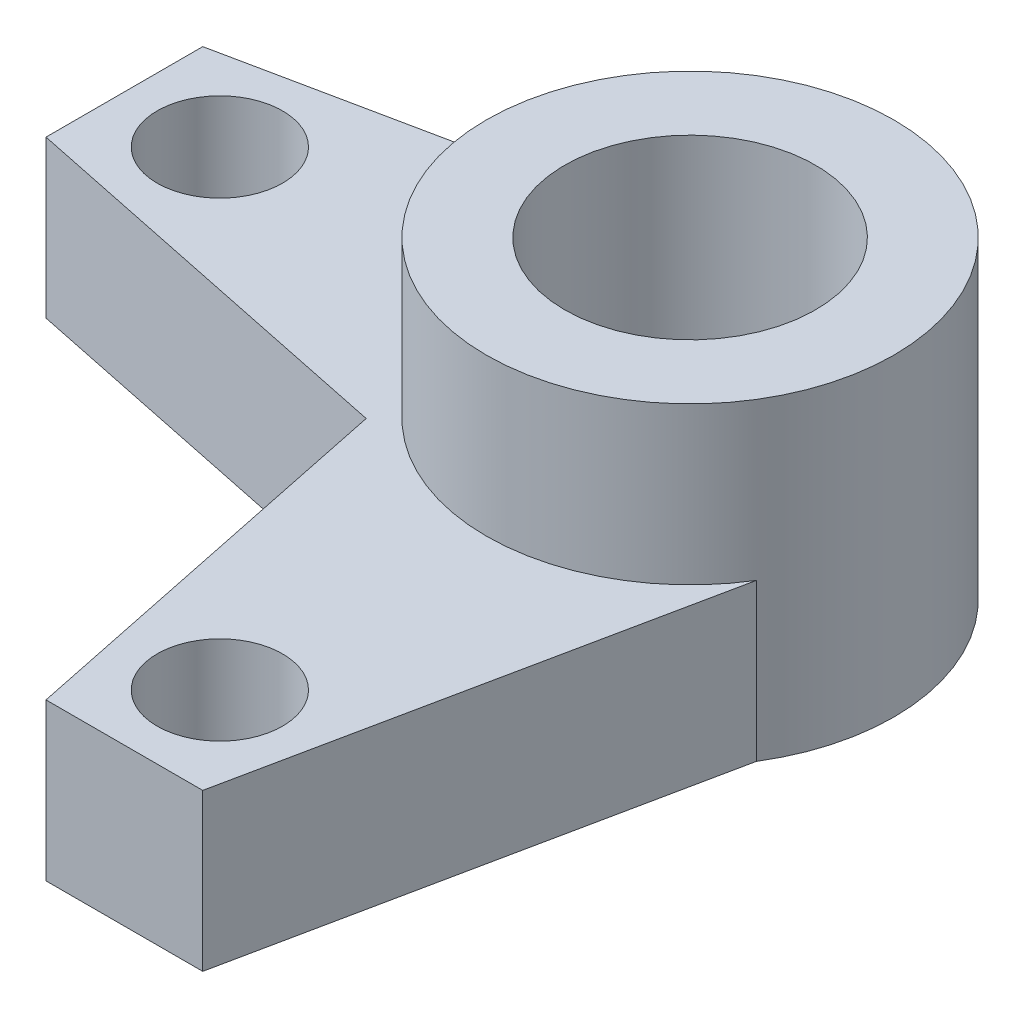
from build123d import *

# Parameters (mm, degrees)
SKETCH1_R           = 2
SKETCH1_R_2         = 4
BOSS_EXTRUDE1_DEPTH = 5
SKETCH1_3_R         = 6.5
SKETCH1_3_R_2       = 4
BOSS_EXTRUDE2_DEPTH = 10


with BuildPart() as part:
    # Sketch1 → Boss-Extrude1 (new body)
    with BuildSketch(Plane(origin=(0, 0, 0), x_dir=(1, 0, 0), z_dir=(0, 1, 0))):
        with BuildLine():
            Line((-3.418800465, 5.528273092), (-18.046143069, 2.5))
            Line((-18.046143069, 2.5), (-18.046143069, -2.5))
            Line((-18.046143069, -2.5), (-5.166458511, -5.166458511))
            Line((-5.166458511, -5.166458511), (-2.5, -18.046143069))
            Line((-2.5, -18.046143069), (2.5, -18.046143069))
            Line((2.5, -18.046143069), (5.528273092, -3.418800465))
            ThreePointArc((5.528273092, -3.418800465), (4.596194078, 4.596194078), (-3.418800465, 5.528273092))
        make_face()
        with Locations(Location((-15, 0, 0), (0, 0, 270))):
            Circle(SKETCH1_R, mode=Mode.SUBTRACT)
        with Locations(Location((0, 0, 0), (0, 0, 270))):
            Circle(SKETCH1_R_2, mode=Mode.SUBTRACT)
        with Locations(Location((0, -15, 0), (0, 0, 270))):
            Circle(SKETCH1_R, mode=Mode.SUBTRACT)
    extrude(amount=BOSS_EXTRUDE1_DEPTH)

    # Sketch1<3> → Boss-Extrude2 (add)
    with BuildSketch(Plane(origin=(0, 0, 0), x_dir=(1, 0, 0), z_dir=(0, 1, 0))):
        with Locations(Location((0, 0, 0), (0, 0, 121.733519153))):
            Circle(SKETCH1_3_R)
        with Locations(Location((0, 0, 0), (0, 0, 270))):
            Circle(SKETCH1_3_R_2, mode=Mode.SUBTRACT)
    extrude(amount=BOSS_EXTRUDE2_DEPTH)


solid = part.part
